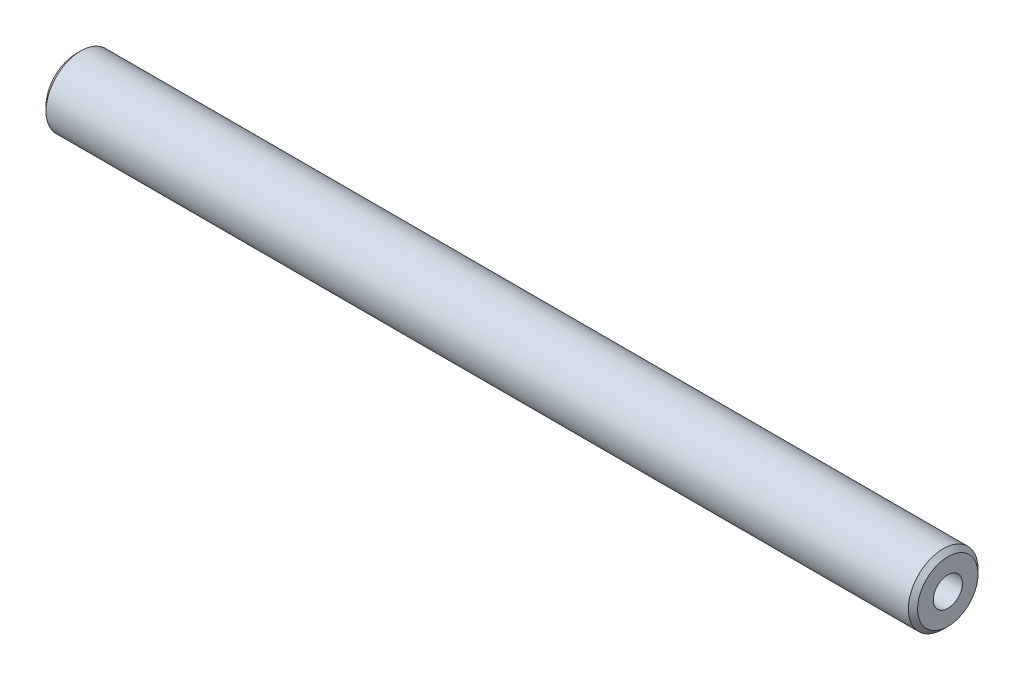
from build123d import *

# Parameters (mm, degrees)
SKETCH1_W           = 75
SKETCH1_H           = 3
CHAMFER1_SIZE       = 0.4
TAPPED_HOLE10_D     = 2.5
TAPPED_HOLE10_DEPTH = 8.5
TAPPED_HOLE10_TIP   = 0.751075774
TAPPED_HOLE11_D     = 2.5
TAPPED_HOLE11_DEPTH = 8.5
TAPPED_HOLE11_TIP   = 0.751075774


with BuildPart() as part:
    # Sketch1 → Revolve1 (revolve)
    with BuildSketch(Plane.XY, mode=Mode.PRIVATE) as revolve1_sk:
        with Locations((37.5, 1.5)):
            Rectangle(SKETCH1_W, SKETCH1_H)
    revolve(revolve1_sk.sketch.rotate(Axis((0, 0, 0), (1, 0, 0)), 90), axis=Axis((0, 0, 0), (1, 0, 0)))

    # Chamfer1
    chamfer1_edges = [part.edges().sort_by_distance(p)[0] for p in [
        (0, 0, -3),
        (75, 0, -3),
    ]]
    chamfer(chamfer1_edges, length=CHAMFER1_SIZE)

    # Tapped Hole10
    with Locations(Plane.ZY):
        with Locations((0, 0)):
            Hole(TAPPED_HOLE10_D / 2, depth=TAPPED_HOLE10_DEPTH)
            with Locations((0, 0, -(TAPPED_HOLE10_DEPTH + TAPPED_HOLE10_TIP / 2))):  # 118° drill point
                Cone(0, TAPPED_HOLE10_D / 2, TAPPED_HOLE10_TIP, mode=Mode.SUBTRACT)

    # Tapped Hole11
    with Locations(Plane(origin=(75, 0, 0), x_dir=(0, 0, -1), z_dir=(1, 0, 0))):
        with Locations((0, 0)):
            Hole(TAPPED_HOLE11_D / 2, depth=TAPPED_HOLE11_DEPTH)
            with Locations((0, 0, -(TAPPED_HOLE11_DEPTH + TAPPED_HOLE11_TIP / 2))):  # 118° drill point
                Cone(0, TAPPED_HOLE11_D / 2, TAPPED_HOLE11_TIP, mode=Mode.SUBTRACT)


solid = part.part
